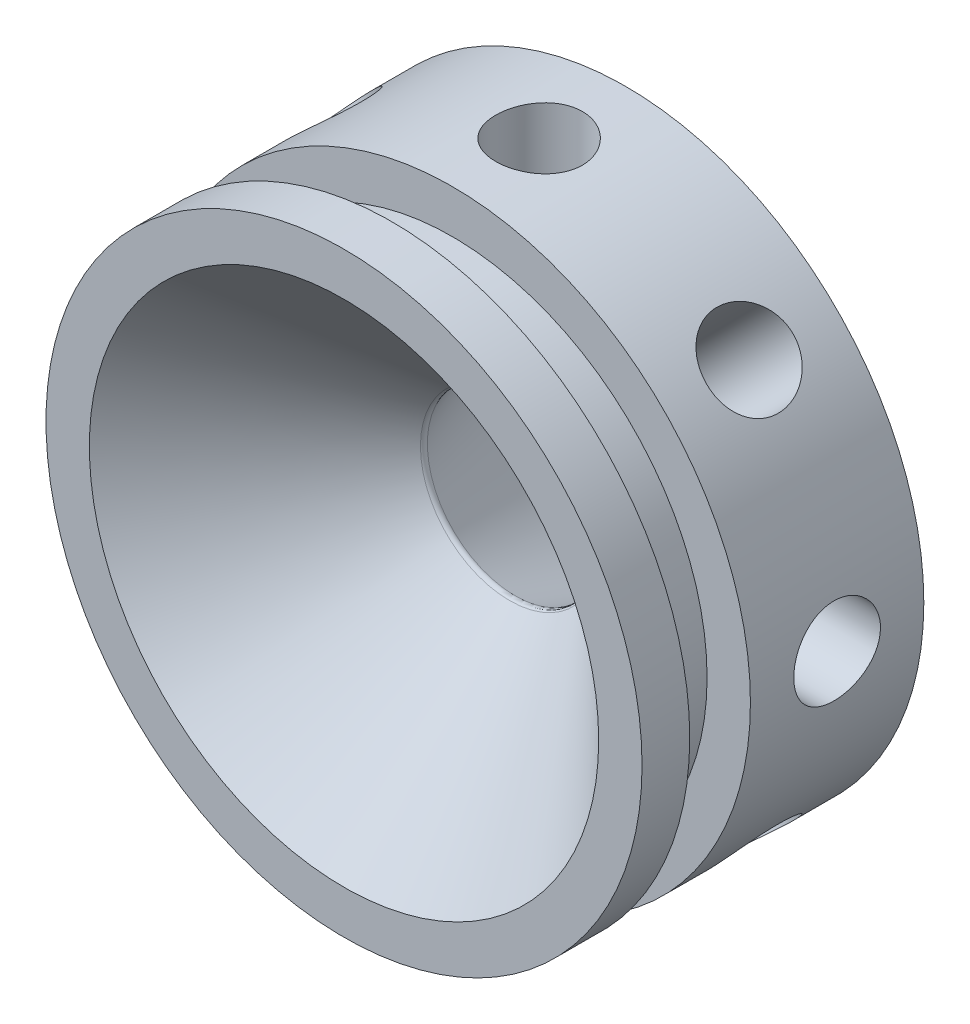
from build123d import *

# Parameters (mm, degrees)
ESBO_O3_R             = 2
CORTE_EXTRUS_O1_DEPTH = 8
PADR_OCIRCULAR1_COUNT = 8
FILETE2_R             = 0.25


with BuildPart() as part:
    # Esboço2 → Revolução1 (revolve)
    with BuildSketch(Plane(origin=(0, 0, 0), x_dir=(1, 0, 0), z_dir=(0, 1, 0))):
        Polygon((0, 0), (-13.75, 0), (-13.75, 2.2), (-11.75, 2.2), (-11.75, 5), (-13.75, 5), (-13.75, 13), (-11.75, 13), (0, 13), align=None)
    revolve(axis=Axis((0, 0, 0), (0, 0, -1)))

    # Esboço3 → Corte-extrusão1 (cut)
    with BuildSketch(Plane(origin=(0, 13.75, 0), x_dir=(1, 0, 0), z_dir=(0, 1, 0))):
        with Locations((0, 9)):
            Circle(ESBO_O3_R)
    corte_extrus_o1 = extrude(amount=-CORTE_EXTRUS_O1_DEPTH, mode=Mode.SUBTRACT)

    # PadrãoCircular1: Corte-extrusão1 ×8 about axis
    padr_ocircular1_axis = Axis((0, 0, 0), (0, 0, -1))
    for i in range(1, PADR_OCIRCULAR1_COUNT):
        add(corte_extrus_o1.rotate(padr_ocircular1_axis, i * 360 / PADR_OCIRCULAR1_COUNT), mode=Mode.SUBTRACT)

    # Esboço12 → Corte-Revolução1 (revolve, cut)
    with BuildSketch(Plane(origin=(0, 0, 0), x_dir=(1, 0, 0), z_dir=(0, 1, 0))):
        Polygon((-4, 7.75), (-11.75, 0), (-2.977226814, 0), (0, 0), (0, 13), (-2.977226814, 13), (-5.91084373, 13), align=None)
    revolve(axis=Axis((0, 0, 0), (0, 0, -1)), mode=Mode.SUBTRACT)

    # Filete2
    filete2_edges = [part.edges().sort_by_distance(p)[0] for p in [
        (4, 0, -7.75),
    ]]
    fillet(filete2_edges, radius=FILETE2_R)


solid = part.part
